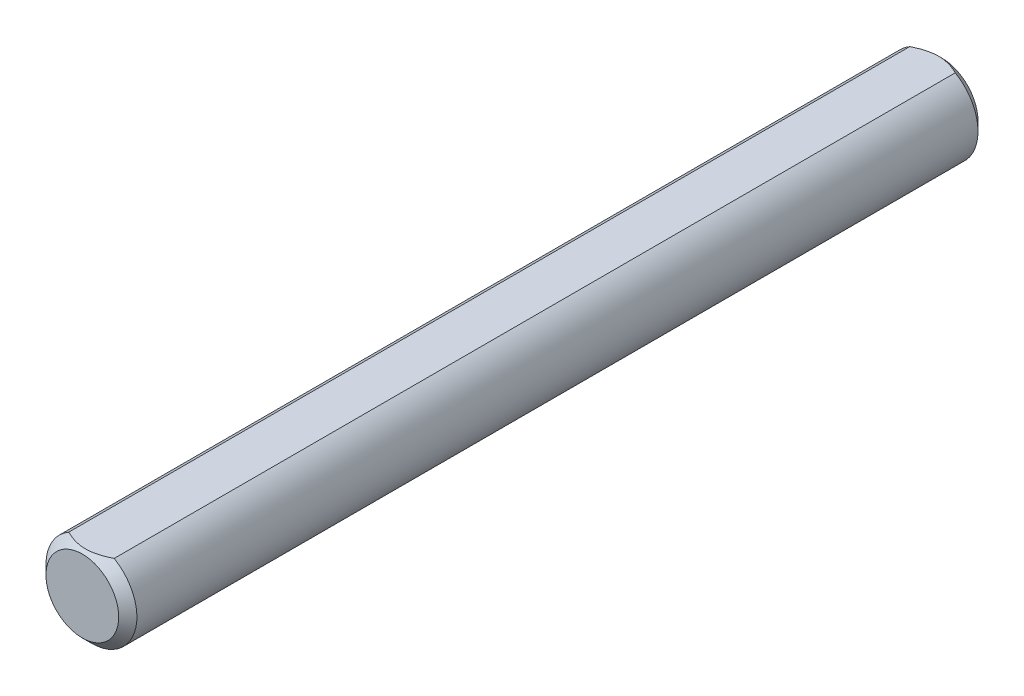
from build123d import *

# Parameters (mm, degrees)
SKETCH1_R           = 3.175
EXTRUDE1_DEPTH      = 30
CHAMFER1_SIZE       = 0.635
EXTRUDE7_DEPTH      = 31.334159787
EXTRUDE7_DEPTH_BACK = 31.334159787


with BuildPart() as part:
    # Sketch1 → Extrude1 (new, symmetric)
    with BuildSketch(Plane.XY):
        Circle(SKETCH1_R)
    extrude(amount=EXTRUDE1_DEPTH, both=True)

    # Chamfer1
    chamfer1_edges = [part.edges().sort_by_distance(p)[0] for p in [
        (-3.175, 0, -30),
        (-3.175, 0, 30),
    ]]
    chamfer(chamfer1_edges, length=CHAMFER1_SIZE)

    # Sketch13 → Extrude7 (cut, two sides: drawn at the far end of the back side and taken through both)
    with BuildSketch(Plane.XY.offset(-EXTRUDE7_DEPTH_BACK)):
        with BuildLine():
            Line((-1.5875, 2.749630657), (1.5875, 2.749630657))
            ThreePointArc((1.5875, 2.749630657), (0, 3.175), (-1.5875, 2.749630657))
        make_face()
    extrude(amount=EXTRUDE7_DEPTH + EXTRUDE7_DEPTH_BACK, mode=Mode.SUBTRACT)


solid = part.part
